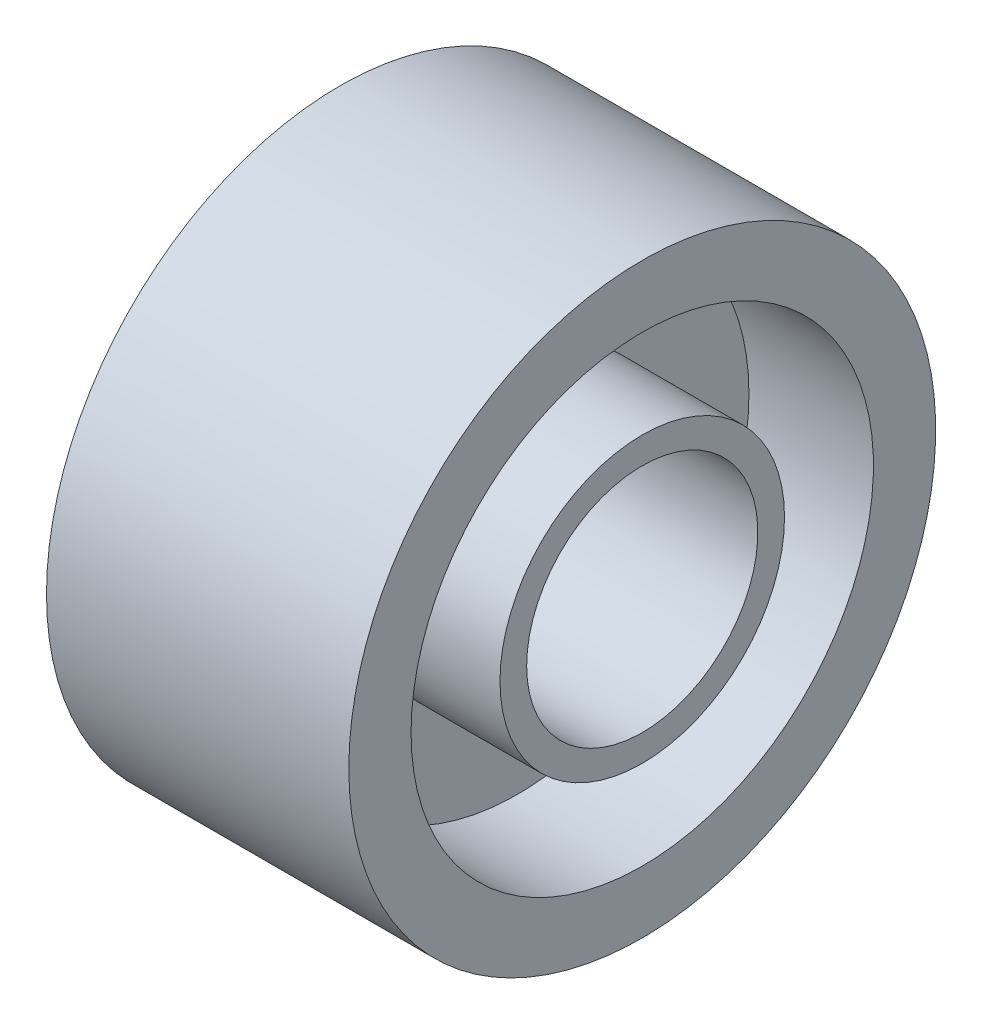
from build123d import *
from build123d.topology import SkipClean

# Parameters (mm, degrees)
SALIENTE_EXTRUIR1_DEPTH      = 1.5
SALIENTE_EXTRUIR1_DEPTH_BACK = 1.5
CROQUIS2_R                   = 16.5
SALIENTE_EXTRUIR2_DEPTH      = 7
SALIENTE_EXTRUIR2_DEPTH_BACK = 10
CROQUIS3_R                   = 16.5
CROQUIS3_R_2                 = 13
CROQUIS3_R_3                 = 8
CROQUIS3_R_4                 = 6.5
CROQUIS4_R                   = 6.5
CORTAR_EXTRUIR1_DEPTH        = 7


with BuildPart() as part:
    # Croquis2 → Saliente-Extruir1 (new, two sides: drawn at the far end of the back side and taken through both)
    with BuildSketch(Plane(origin=(0, 0, 0), x_dir=(0, 0, -1), z_dir=(1, 0, 0)).offset(-SALIENTE_EXTRUIR1_DEPTH_BACK)):
        Circle(CROQUIS2_R)
    extrude(amount=SALIENTE_EXTRUIR1_DEPTH + SALIENTE_EXTRUIR1_DEPTH_BACK)

    # Croquis3 → Saliente-Extruir2 (add, two sides: drawn at the far end of the back side and taken through both)
    # profile 1 of 2: a face of its own
    with SkipClean():  # the faces are left unmerged after this step: merging them gives an invalid solid
        with BuildSketch(Plane.ZY.offset(1.5).offset(-SALIENTE_EXTRUIR2_DEPTH_BACK)):
            Circle(CROQUIS3_R)
            Circle(CROQUIS3_R_2, mode=Mode.SUBTRACT)
        # profile 2 of 2: a face of its own
        with BuildSketch(Plane.ZY.offset(1.5).offset(-SALIENTE_EXTRUIR2_DEPTH_BACK)):
            Circle(CROQUIS3_R_3)
            Circle(CROQUIS3_R_4, mode=Mode.SUBTRACT)
        extrude(amount=SALIENTE_EXTRUIR2_DEPTH + SALIENTE_EXTRUIR2_DEPTH_BACK)

    # Croquis4 → Cortar-Extruir1 (cut)
    with SkipClean():  # the faces are left unmerged after this step: merging them gives an invalid solid
        with BuildSketch(Plane.ZY.offset(1.5)):
            Circle(CROQUIS4_R)
        extrude(amount=-CORTAR_EXTRUIR1_DEPTH, mode=Mode.SUBTRACT)


solid = part.part
